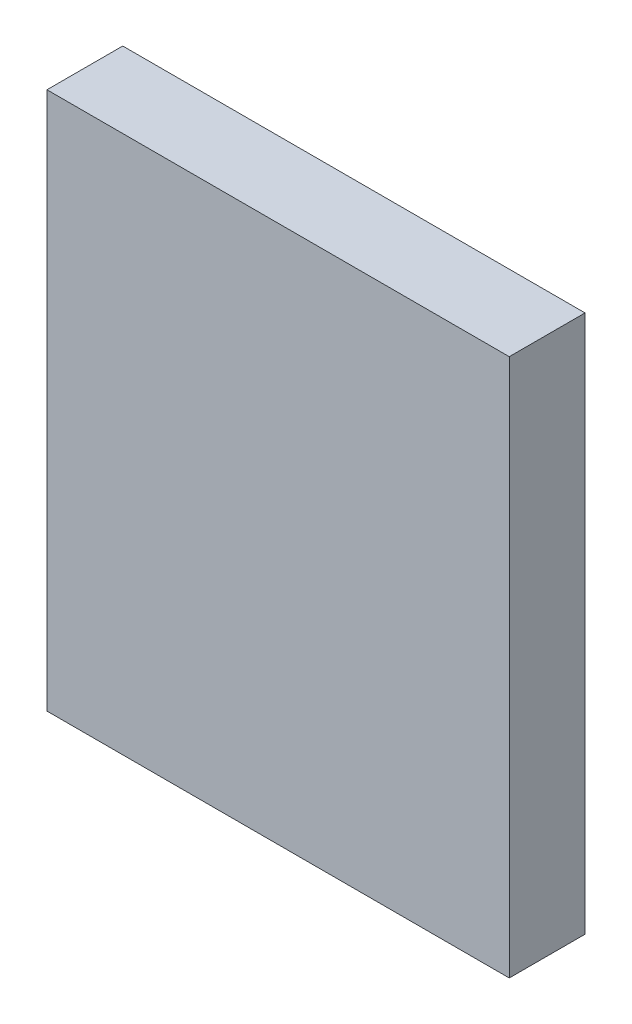
from build123d import *

# Parameters (mm, degrees)
SKETCH_1_W              = 6.1
SKETCH_1_H              = 7.1
COMPONENT_OUTLINE_DEPTH = 1


with BuildPart() as part:
    # 草图1 → Component_Outline (new body)
    with BuildSketch(Plane.XY):
        Rectangle(SKETCH_1_W, SKETCH_1_H)
    extrude(amount=COMPONENT_OUTLINE_DEPTH)


solid = part.part
